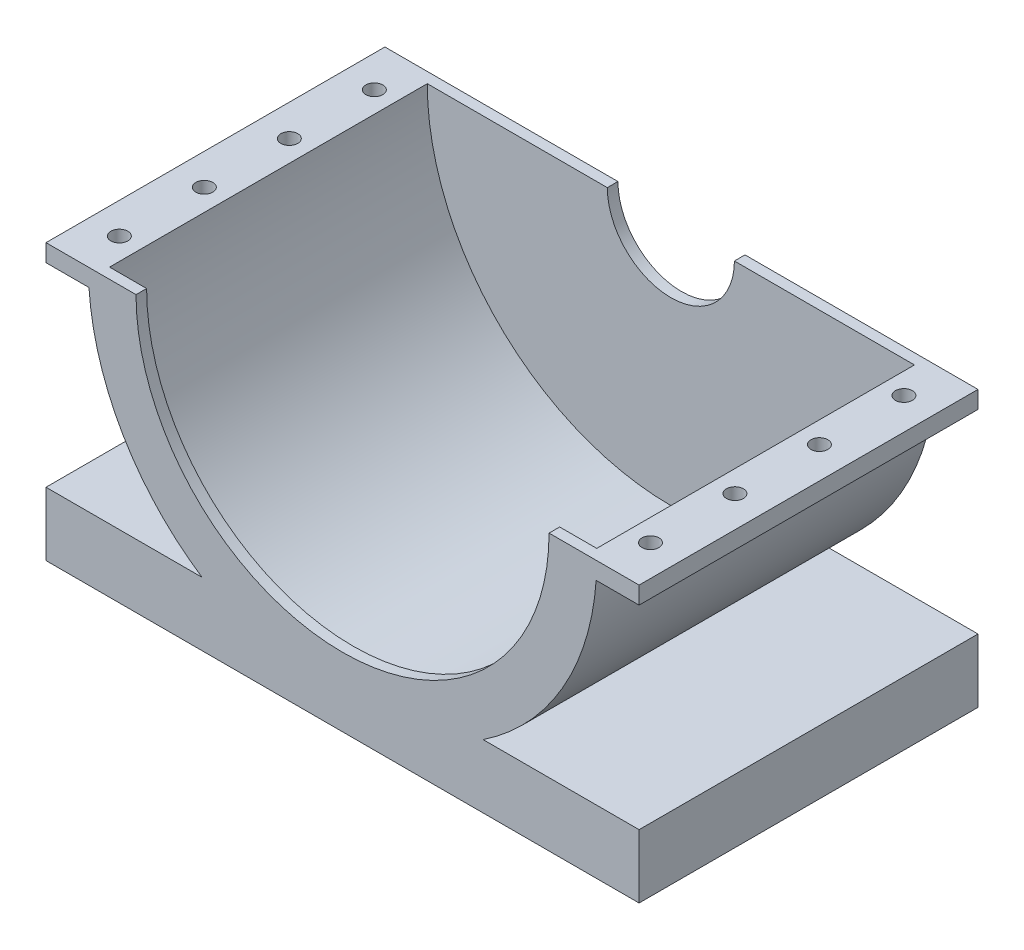
from build123d import *

# Parameters (mm, degrees)
BOSS_EXTRUDE1_DEPTH      = 100
BOSS_EXTRUDE1_DEPTH_BACK = 100
BOSS_EXTRUDE2_START      = -6.25
BOSS_EXTRUDE2_DEPTH      = 6.25
BOSS_EXTRUDE3_DEPTH      = 6.25
CUT_EXTRUDE2_REACH       = 260.904
SKETCH4_R                = 5


with BuildPart() as part:
    # Sketch1 → Boss-Extrude1 (new, two sides: drawn at the far end of the back side and taken through both)
    with BuildSketch(Plane.XY.offset(-BOSS_EXTRUDE1_DEPTH_BACK)):
        with BuildLine():
            Line((-175, 0), (-143.75, 0))
            ThreePointArc((-143.75, 0), (0, -143.75), (143.75, 0))
            Line((143.75, 0), (175, 0))
            Line((175, 0), (175, -10.25))
            Line((175, -10.25), (149.64938189, -10.25))
            ThreePointArc((149.64938189, -10.25), (129.666921854, -75.408814982), (82.915619759, -125))
            Line((82.915619759, -125), (175, -125))
            Line((175, -125), (175, -162.5))
            Line((175, -162.5), (-175, -162.5))
            Line((-175, -162.5), (-175, -125))
            Line((-175, -125), (-82.915619759, -125))
            ThreePointArc((-82.915619759, -125), (-129.666921854, -75.408814982), (-149.64938189, -10.25))
            Line((-149.64938189, -10.25), (-175, -10.25))
            Line((-175, -10.25), (-175, 0))
        make_face()
    extrude(amount=BOSS_EXTRUDE1_DEPTH + BOSS_EXTRUDE1_DEPTH_BACK)

    # Sketch2 → Boss-Extrude2 (add)
    with BuildSketch(Plane.XY.offset(100).offset(BOSS_EXTRUDE2_START)):
        with BuildLine():
            Line((-143.75, 0), (-121.875, 0))
            ThreePointArc((-121.875, 0), (0, -121.875), (121.875, 0))
            Line((121.875, 0), (143.75, 0))
            ThreePointArc((143.75, 0), (0, -143.75), (-143.75, 0))
        make_face()
    extrude(amount=BOSS_EXTRUDE2_DEPTH)

    # Sketch3 → Boss-Extrude3 (add)
    with BuildSketch(Plane(origin=(0, 0, -100), x_dir=(-1, 0, 0), z_dir=(0, 0, -1))):
        with BuildLine():
            Line((-143.75, 0), (-37.5, 0))
            ThreePointArc((-37.5, 0), (0, -37.5), (37.5, 0))
            Line((37.5, 0), (143.75, 0))
            ThreePointArc((143.75, 0), (0, -143.75), (-143.75, 0))
        make_face()
    extrude(amount=-BOSS_EXTRUDE3_DEPTH)

    # Sketch4 → Cut-Extrude2 (cut, up to next)
    with BuildSketch(Plane(origin=(0, 0, 0), x_dir=(1, 0, 0), z_dir=(0, 1, 0)), mode=Mode.PRIVATE) as cut_extrude2_sk1:
        with Locations((156.25, 75)):
            Circle(SKETCH4_R)
    cut_extrude2_tool1 = extrude(cut_extrude2_sk1.sketch, amount=-CUT_EXTRUDE2_REACH, mode=Mode.PRIVATE) & part.part
    # Sketch4 → Cut-Extrude2 (cut, up to next)
    with BuildSketch(Plane(origin=(0, 0, 0), x_dir=(1, 0, 0), z_dir=(0, 1, 0)), mode=Mode.PRIVATE) as cut_extrude2_sk2:
        with Locations((156.403969778, 25.000237067)):
            Circle(SKETCH4_R)
    cut_extrude2_tool2 = extrude(cut_extrude2_sk2.sketch, amount=-CUT_EXTRUDE2_REACH, mode=Mode.PRIVATE) & part.part
    # Sketch4 → Cut-Extrude2 (cut, up to next)
    with BuildSketch(Plane(origin=(0, 0, 0), x_dir=(1, 0, 0), z_dir=(0, 1, 0)), mode=Mode.PRIVATE) as cut_extrude2_sk3:
        with Locations((156.557939555, -24.999525865)):
            Circle(SKETCH4_R)
    cut_extrude2_tool3 = extrude(cut_extrude2_sk3.sketch, amount=-CUT_EXTRUDE2_REACH, mode=Mode.PRIVATE) & part.part
    # Sketch4 → Cut-Extrude2 (cut, up to next)
    with BuildSketch(Plane(origin=(0, 0, 0), x_dir=(1, 0, 0), z_dir=(0, 1, 0)), mode=Mode.PRIVATE) as cut_extrude2_sk4:
        with Locations((156.711909333, -74.999288798)):
            Circle(SKETCH4_R)
    cut_extrude2_tool4 = extrude(cut_extrude2_sk4.sketch, amount=-CUT_EXTRUDE2_REACH, mode=Mode.PRIVATE) & part.part
    # Sketch4 → Cut-Extrude2 (cut, up to next)
    with BuildSketch(Plane(origin=(0, 0, 0), x_dir=(1, 0, 0), z_dir=(0, 1, 0)), mode=Mode.PRIVATE) as cut_extrude2_sk5:
        with Locations((-156.711909333, -74.999288798)):
            Circle(SKETCH4_R)
    cut_extrude2_tool5 = extrude(cut_extrude2_sk5.sketch, amount=-CUT_EXTRUDE2_REACH, mode=Mode.PRIVATE) & part.part
    # Sketch4 → Cut-Extrude2 (cut, up to next)
    with BuildSketch(Plane(origin=(0, 0, 0), x_dir=(1, 0, 0), z_dir=(0, 1, 0)), mode=Mode.PRIVATE) as cut_extrude2_sk6:
        with Locations((-156.557939555, -24.999525865)):
            Circle(SKETCH4_R)
    cut_extrude2_tool6 = extrude(cut_extrude2_sk6.sketch, amount=-CUT_EXTRUDE2_REACH, mode=Mode.PRIVATE) & part.part
    # Sketch4 → Cut-Extrude2 (cut, up to next)
    with BuildSketch(Plane(origin=(0, 0, 0), x_dir=(1, 0, 0), z_dir=(0, 1, 0)), mode=Mode.PRIVATE) as cut_extrude2_sk7:
        with Locations((-156.403969778, 25.000237067)):
            Circle(SKETCH4_R)
    cut_extrude2_tool7 = extrude(cut_extrude2_sk7.sketch, amount=-CUT_EXTRUDE2_REACH, mode=Mode.PRIVATE) & part.part
    # Sketch4 → Cut-Extrude2 (cut, up to next)
    with BuildSketch(Plane(origin=(0, 0, 0), x_dir=(1, 0, 0), z_dir=(0, 1, 0)), mode=Mode.PRIVATE) as cut_extrude2_sk8:
        with Locations((-156.25, 75)):
            Circle(SKETCH4_R)
    cut_extrude2_tool8 = extrude(cut_extrude2_sk8.sketch, amount=-CUT_EXTRUDE2_REACH, mode=Mode.PRIVATE) & part.part
    add(cut_extrude2_tool1.solids().sort_by_distance((156.25, 0, -75))[0], mode=Mode.SUBTRACT)
    add(cut_extrude2_tool2.solids().sort_by_distance((156.40397, 0, -25.000237))[0], mode=Mode.SUBTRACT)
    add(cut_extrude2_tool3.solids().sort_by_distance((156.55794, 0, 24.999526))[0], mode=Mode.SUBTRACT)
    add(cut_extrude2_tool4.solids().sort_by_distance((156.711909, 0, 74.999289))[0], mode=Mode.SUBTRACT)
    add(cut_extrude2_tool5.solids().sort_by_distance((-156.711909, 0, 74.999289))[0], mode=Mode.SUBTRACT)
    add(cut_extrude2_tool6.solids().sort_by_distance((-156.55794, 0, 24.999526))[0], mode=Mode.SUBTRACT)
    add(cut_extrude2_tool7.solids().sort_by_distance((-156.40397, 0, -25.000237))[0], mode=Mode.SUBTRACT)
    add(cut_extrude2_tool8.solids().sort_by_distance((-156.25, 0, -75))[0], mode=Mode.SUBTRACT)


solid = part.part
